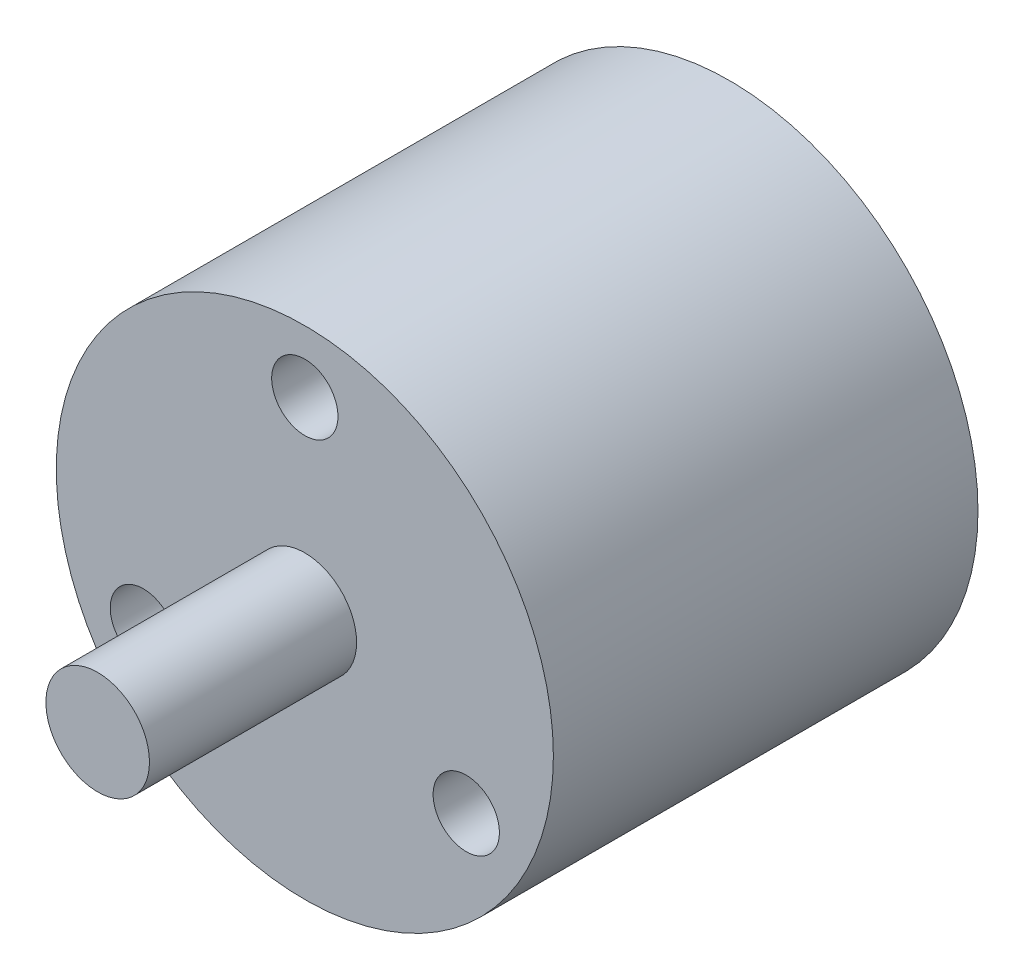
from build123d import *

# Parameters (mm, degrees)
ESQUISSE1_R             = 12
BOSS_EXTRU_1_DEPTH      = 20.5
ESQUISSE2_R             = 2.5
BOSS_EXTRU_2_DEPTH      = 2
ESQUISSE3_R             = 1.6
ENL_V_MAT_EXTRU_1_DEPTH = 3
ESQUISSE4_R             = 2.5
BOSS_EXTRU_3_DEPTH      = 8


with BuildPart() as part:
    # Esquisse1 → Boss.-Extru.1 (new body)
    with BuildSketch(Plane.XY):
        Circle(ESQUISSE1_R)
    extrude(amount=BOSS_EXTRU_1_DEPTH)

    # Esquisse2 → Boss.-Extru.2 (add)
    with BuildSketch(Plane.XY.offset(20.5)):
        Circle(ESQUISSE2_R)
    extrude(amount=BOSS_EXTRU_2_DEPTH)

    # Esquisse3 → Enlèv. mat.-Extru.1 (cut)
    with BuildSketch(Plane.XY.offset(20.5)):
        with Locations((0, 9)):
            Circle(ESQUISSE3_R)
        with Locations((-7.794228634, -4.5)):
            Circle(ESQUISSE3_R)
        with Locations((7.794228634, -4.5)):
            Circle(ESQUISSE3_R)
    extrude(amount=-ENL_V_MAT_EXTRU_1_DEPTH, mode=Mode.SUBTRACT)

    # Esquisse4 → Boss.-Extru.3 (add)
    with BuildSketch(Plane.XY.offset(22.5)):
        Circle(ESQUISSE4_R)
    extrude(amount=BOSS_EXTRU_3_DEPTH)


solid = part.part
